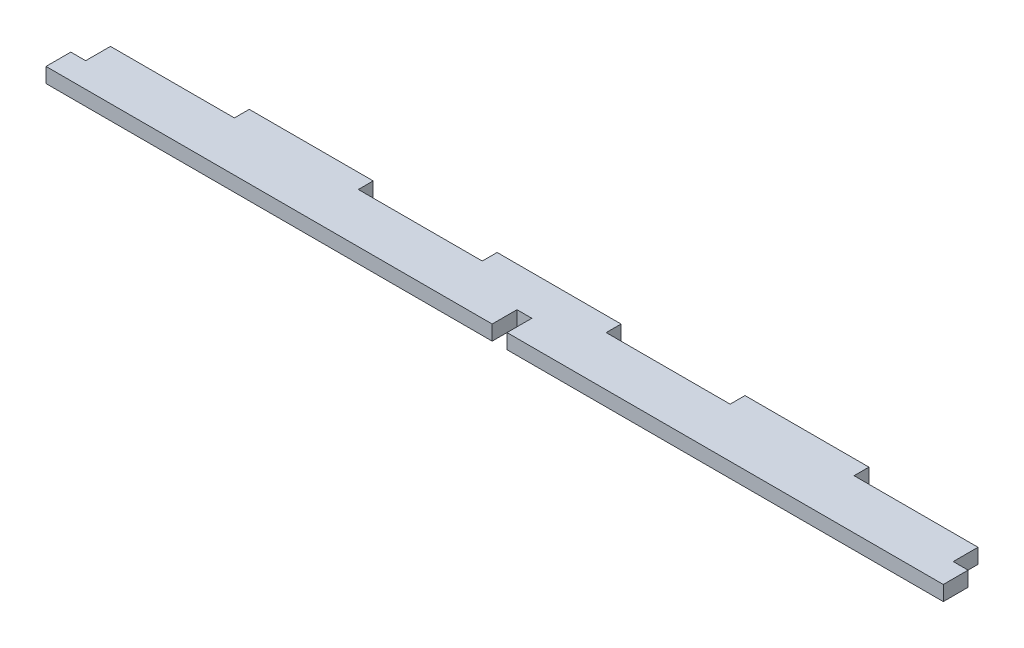
from build123d import *

# Parameters (mm, degrees)
SKICA1_W                 = 175
SKICA1_H                 = 10
P_IDAT_VYSUNUT_M1_DEPTH  = 3
SKICA2_W                 = 3
SKICA2_H                 = 5
SKICA2_W_2               = 25
SKICA2_H_2               = 3
P_IDAT_VYSUNUT_M2_DEPTH  = 3
SKICA3_W                 = 3
SKICA3_H                 = 5
ODEBRAT_VYSUNUT_M1_DEPTH = 179.499299719


with BuildPart() as part:
    # Skica1 → Přidat vysunutím1 (new body)
    with BuildSketch(Plane(origin=(0, 0, 0), x_dir=(1, 0, 0), z_dir=(0, 1, 0))):
        with Locations((87.5, 5)):
            Rectangle(SKICA1_W, SKICA1_H)
    extrude(amount=P_IDAT_VYSUNUT_M1_DEPTH)

    # Skica2 → Přidat vysunutím2 (add)
    with BuildSketch(Plane(origin=(0, 0, 0), x_dir=(1, 0, 0), z_dir=(0, 1, 0))):
        with Locations((-1.5, 2.5)):
            Rectangle(SKICA2_W, SKICA2_H)
        with Locations((176.5, 2.5)):
            Rectangle(SKICA2_W, SKICA2_H)
        with Locations((37.5, 11.5)):
            Rectangle(SKICA2_W_2, SKICA2_H_2)
        with Locations((87.5, 11.5)):
            Rectangle(SKICA2_W_2, SKICA2_H_2)
        with Locations((137.5, 11.5)):
            Rectangle(SKICA2_W_2, SKICA2_H_2)
    extrude(amount=P_IDAT_VYSUNUT_M2_DEPTH)

    # Skica3 → Odebrat vysunutím1 (cut, through all)
    with BuildSketch(Plane(origin=(0, 0, 0), x_dir=(1, 0, 0), z_dir=(0, 1, 0))):
        with Locations((88.5, 2.5)):
            Rectangle(SKICA3_W, SKICA3_H)
    extrude(amount=ODEBRAT_VYSUNUT_M1_DEPTH, mode=Mode.SUBTRACT)


solid = part.part
